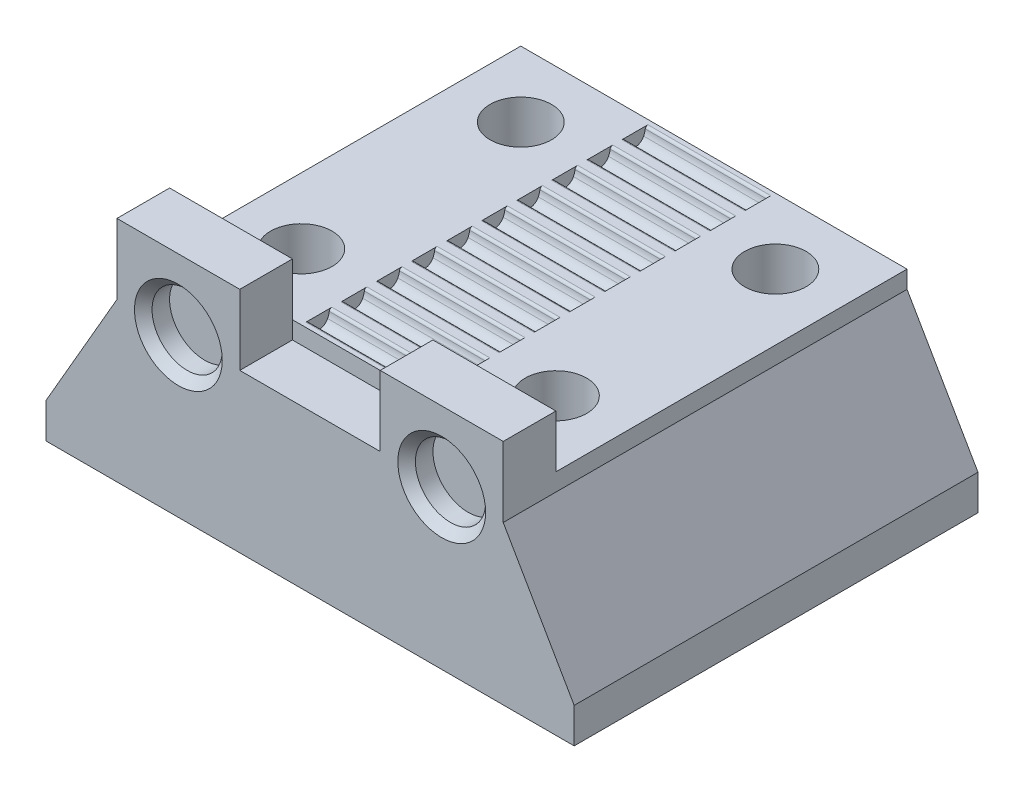
from build123d import *

# Parameters (mm, degrees)
ESTRUSIONE_ESTRUSIONE1_DEPTH = 10
TAGLIO_ESTRUSIONE6_DEPTH     = 3.5
SCHIZZO3_R                   = 1.75
TAGLIO_ESTRUSIONE7_DEPTH     = 21.645708387
ESTRUSIONE_ESTRUSIONE2_DEPTH = 3
SCHIZZO5_R                   = 2
TAGLIO_ESTRUSIONE8_DEPTH     = 1.5
SMUSSO2_SIZE                 = 0.5
TAGLIO_ESTRUSIONE9_DEPTH     = 3.5


with BuildPart() as part:
    # Schizzo1 → Estrusione-Estrusione1 (new, symmetric)
    with BuildSketch(Plane.XY):
        Polygon((11, -1), (11, 0), (-11, 0), (-11, -1), (-15.041451884, -8), (-15.041451884, -10), (15.041451884, -10), (15.041451884, -8), align=None)
    extrude(amount=ESTRUSIONE_ESTRUSIONE1_DEPTH, both=True)

    # Schizzo2 → Taglio-Estrusione6 (cut, symmetric)
    with BuildSketch(Plane(origin=(0, 0, 0), x_dir=(0, 0, -1), z_dir=(1, 0, 0))):
        with BuildLine():
            Line((-10, 0), (-9.740175425, 0))
            ThreePointArc((-9.740175425, 0), (-9.641268354, -0.037228588), (-9.591456891, -0.130434783))
            ThreePointArc((-9.591456891, -0.130434783), (-9.557611714, -0.288062154), (-9.498876404, -0.438202247))
            ThreePointArc((-9.498876404, -0.438202247), (-9, -0.75), (-8.501123596, -0.438202247))
            ThreePointArc((-8.501123596, -0.438202247), (-8.442388286, -0.288062154), (-8.408543109, -0.130434783))
            ThreePointArc((-8.408543109, -0.130434783), (-8.358731646, -0.037228588), (-8.259824575, 0))
            Line((-8.259824575, 0), (-8, 0))
            Line((-8, 0), (-7.740175425, 0))
            ThreePointArc((-7.740175425, 0), (-7.641268354, -0.037228588), (-7.591456891, -0.130434783))
            ThreePointArc((-7.591456891, -0.130434783), (-7.557611714, -0.288062154), (-7.498876404, -0.438202247))
            ThreePointArc((-7.498876404, -0.438202247), (-7, -0.75), (-6.501123596, -0.438202247))
            ThreePointArc((-6.501123596, -0.438202247), (-6.442388286, -0.288062154), (-6.408543109, -0.130434783))
            ThreePointArc((-6.408543109, -0.130434783), (-6.358731646, -0.037228588), (-6.259824575, 0))
            Line((-6.259824575, 0), (-6, 0))
            Line((-6, 0), (-5.740175425, 0))
            ThreePointArc((-5.740175425, 0), (-5.641268354, -0.037228588), (-5.591456891, -0.130434783))
            ThreePointArc((-5.591456891, -0.130434783), (-5.557611714, -0.288062154), (-5.498876404, -0.438202247))
            ThreePointArc((-5.498876404, -0.438202247), (-5, -0.75), (-4.501123596, -0.438202247))
            ThreePointArc((-4.501123596, -0.438202247), (-4.442388286, -0.288062154), (-4.408543109, -0.130434783))
            ThreePointArc((-4.408543109, -0.130434783), (-4.358731646, -0.037228588), (-4.259824575, 0))
            Line((-4.259824575, 0), (-4, 0))
            Line((-4, 0), (-3.740175425, 0))
            ThreePointArc((-3.740175425, 0), (-3.641268354, -0.037228588), (-3.591456891, -0.130434783))
            ThreePointArc((-3.591456891, -0.130434783), (-3.557611714, -0.288062154), (-3.498876404, -0.438202247))
            ThreePointArc((-3.498876404, -0.438202247), (-3, -0.75), (-2.501123596, -0.438202247))
            ThreePointArc((-2.501123596, -0.438202247), (-2.442388286, -0.288062154), (-2.408543109, -0.130434783))
            ThreePointArc((-2.408543109, -0.130434783), (-2.358731646, -0.037228588), (-2.259824575, 0))
            Line((-2.259824575, 0), (-2, 0))
            Line((-2, 0), (-1.740175425, 0))
            ThreePointArc((-1.740175425, 0), (-1.641268354, -0.037228588), (-1.591456891, -0.130434783))
            ThreePointArc((-1.591456891, -0.130434783), (-1.557611714, -0.288062154), (-1.498876404, -0.438202247))
            ThreePointArc((-1.498876404, -0.438202247), (-1, -0.75), (-0.501123596, -0.438202247))
            ThreePointArc((-0.501123596, -0.438202247), (-0.442388286, -0.288062154), (-0.408543109, -0.130434783))
            ThreePointArc((-0.408543109, -0.130434783), (-0.358731646, -0.037228588), (-0.259824575, 0))
            Line((-0.259824575, 0), (0, 0))
            Line((0, 0), (0.259824575, 0))
            ThreePointArc((0.259824575, 0), (0.358731646, -0.037228588), (0.408543109, -0.130434783))
            ThreePointArc((0.408543109, -0.130434783), (0.442388286, -0.288062154), (0.501123596, -0.438202247))
            ThreePointArc((0.501123596, -0.438202247), (1, -0.75), (1.498876404, -0.438202247))
            ThreePointArc((1.498876404, -0.438202247), (1.557611714, -0.288062154), (1.591456891, -0.130434783))
            ThreePointArc((1.591456891, -0.130434783), (1.641268354, -0.037228588), (1.740175425, 0))
            Line((1.740175425, 0), (2, 0))
            Line((2, 0), (2.259824575, 0))
            ThreePointArc((2.259824575, 0), (2.358731646, -0.037228588), (2.408543109, -0.130434783))
            ThreePointArc((2.408543109, -0.130434783), (2.442388286, -0.288062154), (2.501123596, -0.438202247))
            ThreePointArc((2.501123596, -0.438202247), (3, -0.75), (3.498876404, -0.438202247))
            ThreePointArc((3.498876404, -0.438202247), (3.557611714, -0.288062154), (3.591456891, -0.130434783))
            ThreePointArc((3.591456891, -0.130434783), (3.641268354, -0.037228588), (3.740175425, 0))
            Line((3.740175425, 0), (4, 0))
            Line((4, 0), (4.259824575, 0))
            ThreePointArc((4.259824575, 0), (4.358731646, -0.037228588), (4.408543109, -0.130434783))
            ThreePointArc((4.408543109, -0.130434783), (4.442388286, -0.288062154), (4.501123596, -0.438202247))
            ThreePointArc((4.501123596, -0.438202247), (5, -0.75), (5.498876404, -0.438202247))
            ThreePointArc((5.498876404, -0.438202247), (5.557611714, -0.288062154), (5.591456891, -0.130434783))
            ThreePointArc((5.591456891, -0.130434783), (5.641268354, -0.037228588), (5.740175425, 0))
            Line((5.740175425, 0), (6, 0))
            Line((6, 0), (6.259824575, 0))
            ThreePointArc((6.259824575, 0), (6.358731646, -0.037228588), (6.408543109, -0.130434783))
            ThreePointArc((6.408543109, -0.130434783), (6.442388286, -0.288062154), (6.501123596, -0.438202247))
            ThreePointArc((6.501123596, -0.438202247), (7, -0.75), (7.498876404, -0.438202247))
            ThreePointArc((7.498876404, -0.438202247), (7.557611714, -0.288062154), (7.591456891, -0.130434783))
            ThreePointArc((7.591456891, -0.130434783), (7.641268354, -0.037228588), (7.740175425, 0))
            Line((7.740175425, 0), (8, 0))
            Line((8, 0), (8.259824575, 0))
            ThreePointArc((8.259824575, 0), (8.358731646, -0.037228588), (8.408543109, -0.130434783))
            ThreePointArc((8.408543109, -0.130434783), (8.442388286, -0.288062154), (8.501123596, -0.438202247))
            ThreePointArc((8.501123596, -0.438202247), (9, -0.75), (9.498876404, -0.438202247))
            ThreePointArc((9.498876404, -0.438202247), (9.557611714, -0.288062154), (9.591456891, -0.130434783))
            ThreePointArc((9.591456891, -0.130434783), (9.641268354, -0.037228588), (9.740175425, 0))
            Line((9.740175425, 0), (10, 0))
            Line((10, 0), (10, 1.47712545))
            Line((10, 1.47712545), (-10, 1.47712545))
            Line((-10, 1.47712545), (-10, 0))
        make_face()
    extrude(amount=TAGLIO_ESTRUSIONE6_DEPTH, both=True, mode=Mode.SUBTRACT)

    # Schizzo3 → Taglio-Estrusione7 (cut, through all)
    with BuildSketch(Plane(origin=(0, 0, 0), x_dir=(1, 0, 0), z_dir=(0, 1, 0))):
        with Locations(Location((7.25, 6.25, 0), (0, 0, 180))):
            Circle(SCHIZZO3_R)
        with Locations(Location((7.25, -6.25, 0), (0, 0, 180))):
            Circle(SCHIZZO3_R)
        with Locations(Location((-7.25, -6.25, 0), (0, 0, 180))):
            Circle(SCHIZZO3_R)
        with Locations(Location((-7.25, 6.25, 0), (0, 0, 180))):
            Circle(SCHIZZO3_R)
    extrude(amount=-TAGLIO_ESTRUSIONE7_DEPTH, mode=Mode.SUBTRACT)

    # Schizzo4 → Estrusione-Estrusione2 (add)
    with BuildSketch(Plane.XY.offset(10)):
        Polygon((-15.041451884, -10), (15.041451884, -10), (15.041451884, -8), (11, -1), (11, 3), (3.994785695, 3), (3.994785695, -1), (-4.005214305, -1), (-4.005214305, 3), (-11, 3), (-11, -1), (-15.041451884, -8), align=None)
    extrude(amount=ESTRUSIONE_ESTRUSIONE2_DEPTH)

    # Schizzo5 → Taglio-Estrusione8 (cut)
    with BuildSketch(Plane.XY.offset(13)):
        with Locations((7.497392847, -1)):
            Circle(SCHIZZO5_R)
        with Locations((-7.502607153, -1)):
            Circle(SCHIZZO5_R)
    extrude(amount=-TAGLIO_ESTRUSIONE8_DEPTH, mode=Mode.SUBTRACT)

    # Smusso2
    smusso2_edges = [part.edges().sort_by_distance(p)[0] for p in [
        (5.497392847, -1, 13),
        (-9.502607153, -1, 13),
    ]]
    chamfer(smusso2_edges, length=SMUSSO2_SIZE)

    # Schizzo6 → Taglio-Estrusione9 (cut)
    with BuildSketch(Plane.XZ.offset(10)):
        Polygon((-8.9, 9.107883832), (-10.55, 6.25), (-8.9, 3.392116168), (-5.6, 3.392116168), (-3.95, 6.25), (-5.6, 9.107883832), align=None)
        Polygon((-5.6, -3.392116168), (-8.9, -3.392116168), (-10.55, -6.25), (-8.9, -9.107883832), (-5.6, -9.107883832), (-3.95, -6.25), align=None)
        Polygon((10.55, -6.25), (8.9, -3.392116168), (5.6, -3.392116168), (3.95, -6.25), (5.6, -9.107883832), (8.9, -9.107883832), align=None)
        Polygon((5.6, 3.392116168), (8.9, 3.392116168), (10.55, 6.25), (8.9, 9.107883832), (5.6, 9.107883832), (3.95, 6.25), align=None)
    extrude(amount=-TAGLIO_ESTRUSIONE9_DEPTH, mode=Mode.SUBTRACT)


solid = part.part
